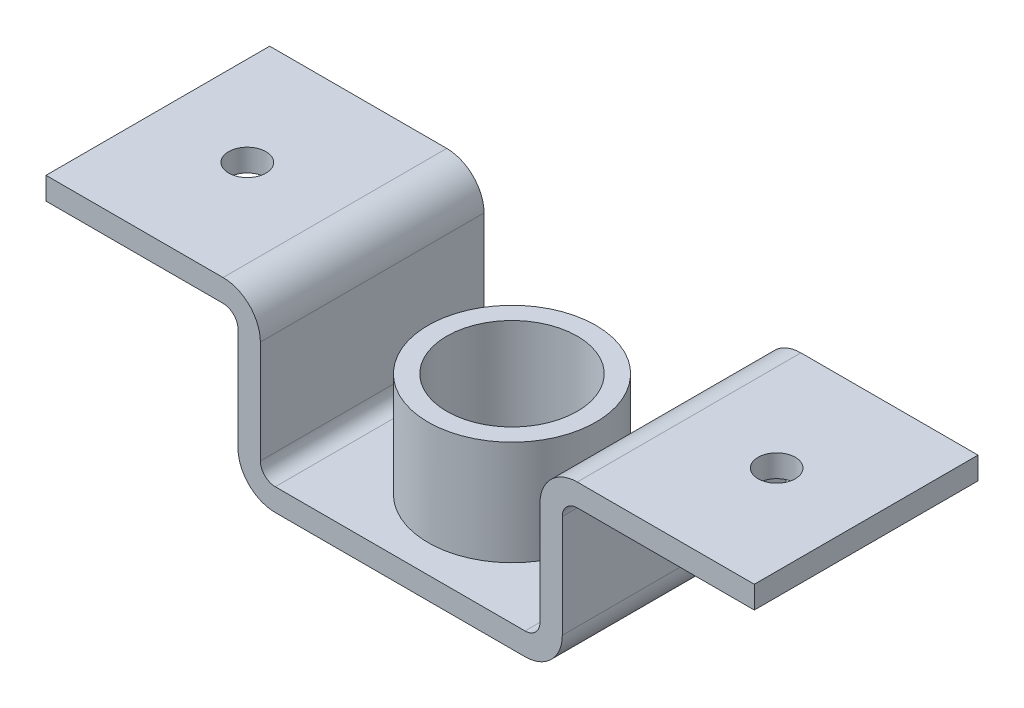
from build123d import *

# Parameters (mm, degrees)
BOSS_EXTRUDE1_DEPTH = 300
BOSS_EXTRUDE2_START = -30
SKETCH2_R           = 112.5
SKETCH2_R_2         = 87.5
BOSS_EXTRUDE2_DEPTH = 170
SKETCH3_R           = 37.5
SKETCH3_R_2         = 25
CUT_EXTRUDE1_DEPTH  = 1025.277306202


with BuildPart() as part:
    # Sketch1 → Boss-Extrude1 (new body)
    with BuildSketch(Plane.XY):
        with BuildLine():
            Line((0, 0), (237.5, 0))
            ThreePointArc((237.5, 0), (272.855339059, -14.644660941), (287.5, -50))
            Line((287.5, -50), (287.5, -188))
            ThreePointArc((287.5, -188), (293.357864376, -202.142135624), (307.5, -208))
            Line((307.5, -208), (642.5, -208))
            ThreePointArc((642.5, -208), (656.642135624, -202.142135624), (662.5, -188))
            Line((662.5, -188), (662.5, -50))
            ThreePointArc((662.5, -50), (677.144660941, -14.644660941), (712.5, 0))
            Line((712.5, 0), (950, 0))
            Line((950, 0), (950, -30))
            Line((950, -30), (712.5, -30))
            ThreePointArc((712.5, -30), (698.357864376, -35.857864376), (692.5, -50))
            Line((692.5, -50), (692.5, -188))
            ThreePointArc((692.5, -188), (677.855339059, -223.355339059), (642.5, -238))
            Line((642.5, -238), (307.5, -238))
            ThreePointArc((307.5, -238), (272.144660941, -223.355339059), (257.5, -188))
            Line((257.5, -188), (257.5, -50))
            ThreePointArc((257.5, -50), (251.642135624, -35.857864376), (237.5, -30))
            Line((237.5, -30), (0, -30))
            Line((0, -30), (0, 0))
        make_face()
    extrude(amount=BOSS_EXTRUDE1_DEPTH)

    # Sketch2 → Boss-Extrude2 (add)
    with BuildSketch(Plane(origin=(0, -208, 0), x_dir=(1, 0, 0), z_dir=(0, 1, 0)).offset(BOSS_EXTRUDE2_START)):
        with Locations(Location((475, -150, 0), (0, 0, 90))):
            Circle(SKETCH2_R)
        with Locations(Location((475, -150, 0), (0, 0, 90))):
            Circle(SKETCH2_R_2, mode=Mode.SUBTRACT)
    extrude(amount=BOSS_EXTRUDE2_DEPTH)

    # Sketch3 → Cut-Extrude1 (cut, through all)
    with BuildSketch(Plane.XZ.offset(238)):
        with Locations(Location((475, 150, 0), (0, 0, 270))):
            Circle(SKETCH3_R)
        with Locations(Location((830, 150, 0), (0, 0, 270))):
            Circle(SKETCH3_R_2)
        with Locations(Location((120, 150, 0), (0, 0, 270))):
            Circle(SKETCH3_R_2)
    extrude(amount=-CUT_EXTRUDE1_DEPTH, mode=Mode.SUBTRACT)


solid = part.part
